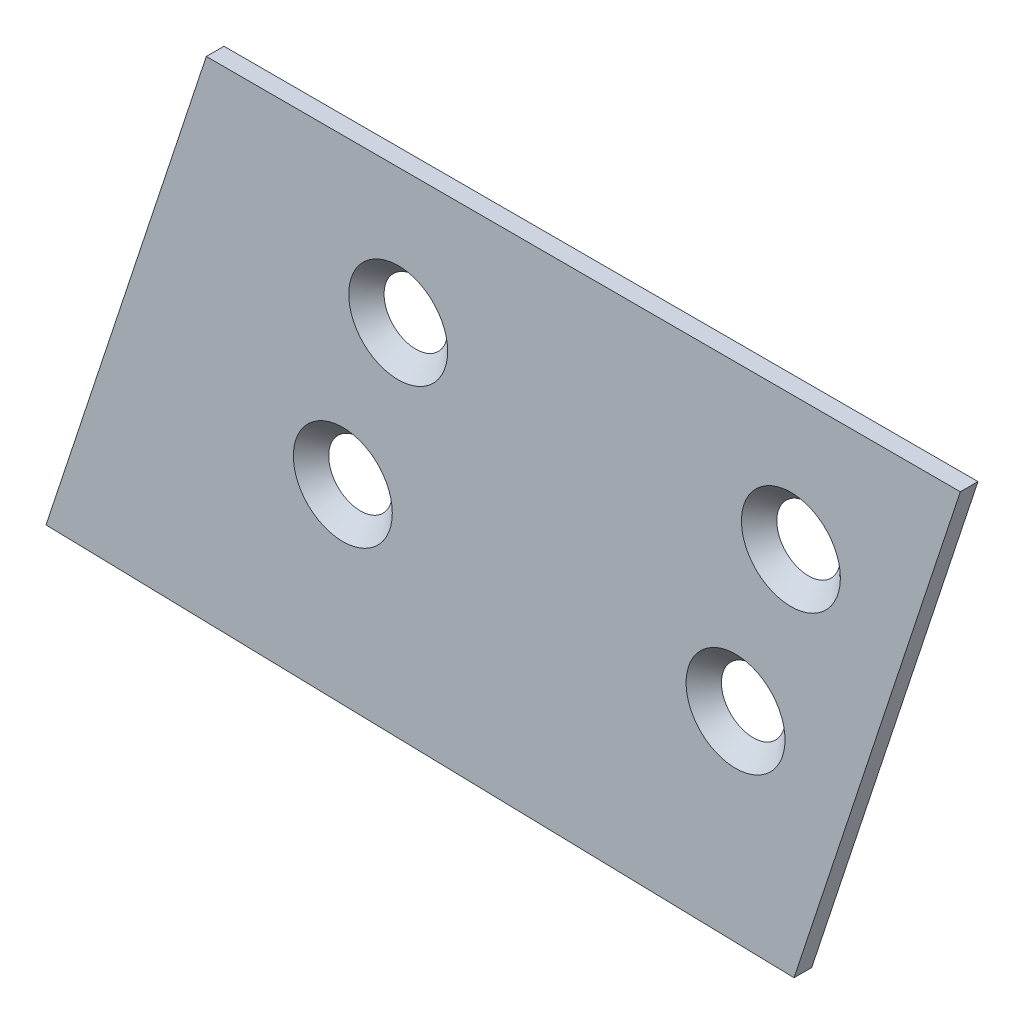
from build123d import *

# Parameters (mm, degrees)
BOSS_EXTRUDE1_DEPTH          = 2
BOSS_EXTRUDE2_DEPTH          = 2
SKETCH4_R                    = 2.5
CUT_EXTRUDE2_DEPTH           = 2
CSK_FOR_M5_SFHCS1_AT_2_COUNT = 2
CSK_FOR_M5_SFHCS1_AT_2_PITCH = 44.45
CSK_FOR_M5_SFHCS1_AT_3_COUNT = 2
CSK_FOR_M5_SFHCS1_AT_3_PITCH = 42.64624896
CSK_FOR_M5_SFHCS1_AT_4_COUNT = 2
CSK_FOR_M5_SFHCS1_AT_4_PITCH = 20


with BuildPart() as part:
    # Sketch2 → Boss-Extrude1 (new body)
    with BuildSketch(Plane.XY):
        Polygon((-54.61917065, -24.589230235), (30.72482935, -24.589230235), (13.852659447, -75.725684813), (-71.491340553, -75.725684813), align=None)
    extrude(amount=BOSS_EXTRUDE1_DEPTH)

    # Sketch3 → Boss-Extrude2 (add)
    with BuildSketch(Plane.XY.offset(2)):
        Polygon((-72.764711867, -79.585039875), (11.90144755, -81.639450446), (13.852659447, -75.725684813), (-71.491340553, -75.725684813), align=None)
    extrude(amount=-BOSS_EXTRUDE2_DEPTH)

    # Sketch4 → Cut-Extrude2 (cut)
    with BuildSketch(Plane.XY.offset(2)):
        with Locations((-32.900665919, -39.829230235)):
            Circle(SKETCH4_R)
        with Locations((11.549334081, -39.829230235)):
            Circle(SKETCH4_R)
        with Locations((5.282742972, -58.822119322)):
            Circle(SKETCH4_R)
        with Locations((-39.167257028, -58.822119322)):
            Circle(SKETCH4_R)
    extrude(amount=-CUT_EXTRUDE2_DEPTH, mode=Mode.SUBTRACT)

    # Sketch6 → CSK for M5 SFHCS1 (revolve, cut)
    with BuildSketch(Plane(origin=(-32.900665919, -39.829230235, 2), x_dir=(0, -1, 0), z_dir=(1, 0, 0))):
        Polygon((0, 0), (0, 2), (2.75, 2), (2.75, 2.85), (5.6, 0), align=None)
    csk_for_m5_sfhcs1 = revolve(axis=Axis((-32.900665919, -39.829230235, 8.35), (0, 0, -1)), mode=Mode.SUBTRACT)

    # CSK for M5 SFHCS1 at 2: CSK for M5 SFHCS1 ×2
    with Locations(*[(i * CSK_FOR_M5_SFHCS1_AT_2_PITCH, 0, 0) for i in range(1, CSK_FOR_M5_SFHCS1_AT_2_COUNT)]):
        add(csk_for_m5_sfhcs1, mode=Mode.SUBTRACT)

    # CSK for M5 SFHCS1 at 3: CSK for M5 SFHCS1 ×2
    with Locations(*[Vector(0.8953521076667903, -0.44535896004979675, 0) * (i * CSK_FOR_M5_SFHCS1_AT_3_PITCH) for i in range(1, CSK_FOR_M5_SFHCS1_AT_3_COUNT)]):
        add(csk_for_m5_sfhcs1, mode=Mode.SUBTRACT)

    # CSK for M5 SFHCS1 at 4: CSK for M5 SFHCS1 ×2
    with Locations(*[Vector(-0.31332955547970925, -0.9496444543421964, 0) * (i * CSK_FOR_M5_SFHCS1_AT_4_PITCH) for i in range(1, CSK_FOR_M5_SFHCS1_AT_4_COUNT)]):
        add(csk_for_m5_sfhcs1, mode=Mode.SUBTRACT)


solid = part.part
